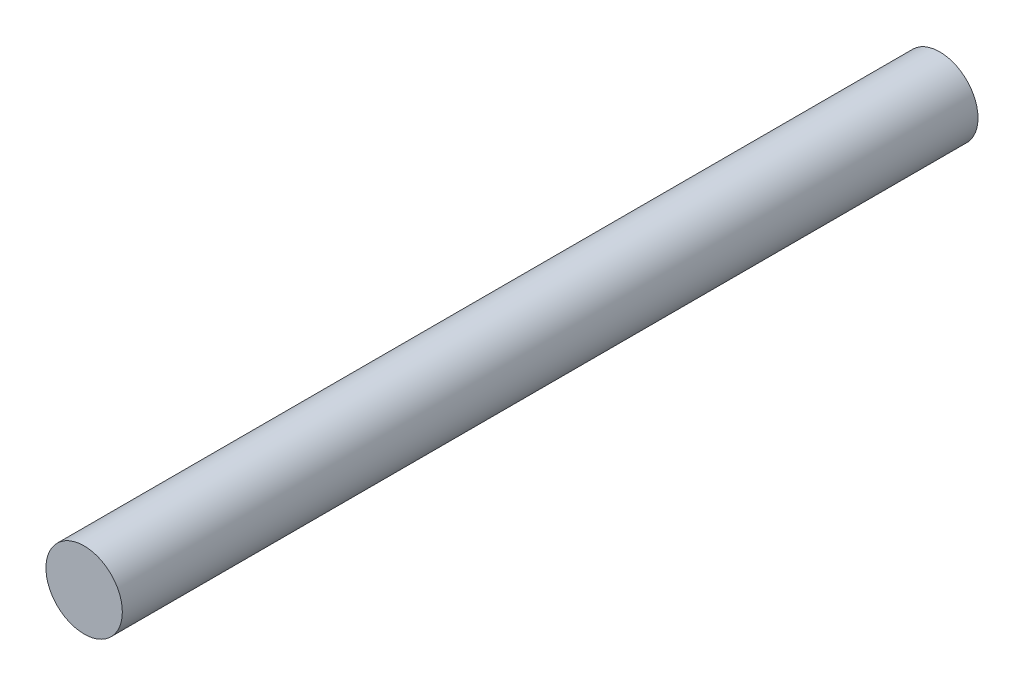
from build123d import *

# Parameters (mm, degrees)
SKETCH1_R           = 1.984375
BOSS_EXTRUDE1_DEPTH = 44.45


with BuildPart() as part:
    # Sketch1 → Boss-Extrude1 (new body)
    with BuildSketch(Plane.XY):
        Circle(SKETCH1_R)
    extrude(amount=BOSS_EXTRUDE1_DEPTH)


solid = part.part
